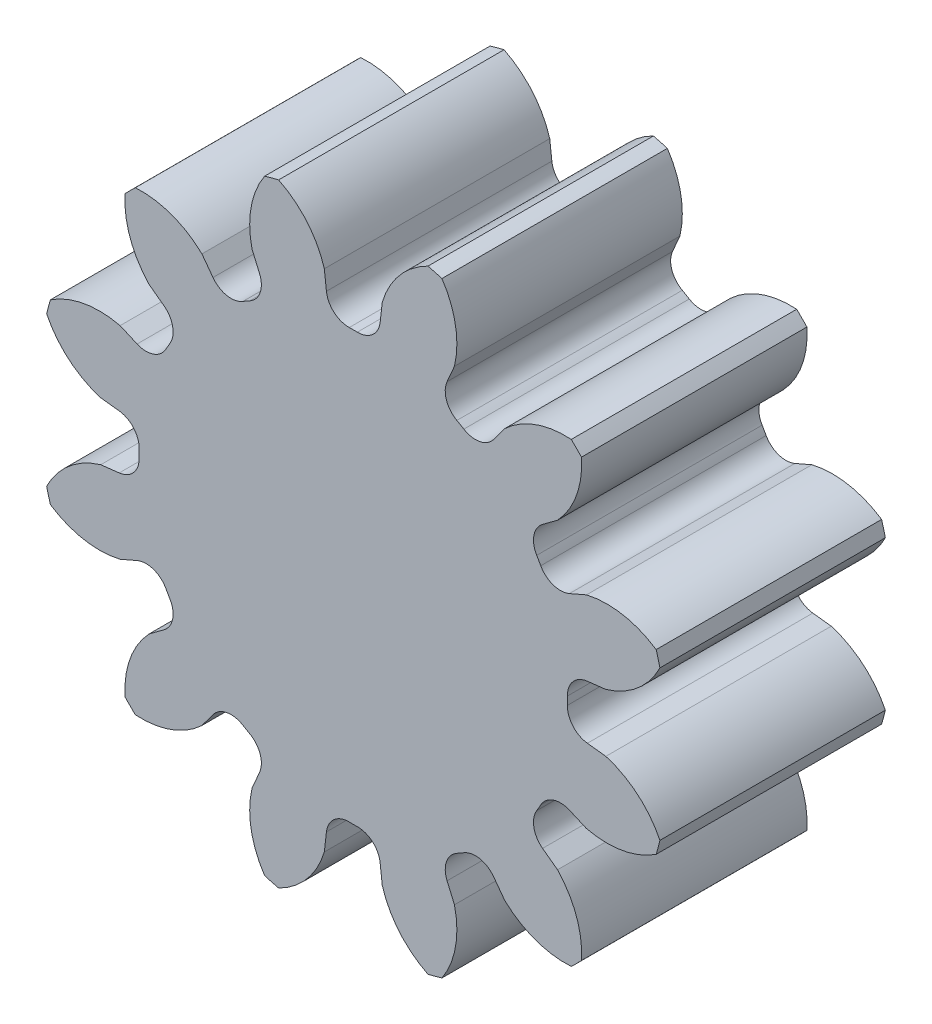
from build123d import *

# Parameters (mm, degrees)
SKETCH1_R                                = 7
DA_CIRCLE_DEPTH                          = 2.5
ONE_TEETH_DEPTH                          = 11.210288928
FILLET_FOR_HIGH_R                        = 0.5
CIRPATTERN_FOR_HIGH_COUNT                = 12
FILLET_FOR_HIGH_OF_CIRPATTERN_FOR_HIGH_R = 0.5


with BuildPart() as part:
    # Sketch1 → Da_circle (new, symmetric)
    with BuildSketch(Plane.XY):
        Circle(SKETCH1_R)
    extrude(amount=DA_CIRCLE_DEPTH, both=True)

    # Sketch → one_teeth (cut, symmetric)
    with BuildSketch(Plane.XY):
        with BuildLine():
            ThreePointArc((-0.54138974, 4.719046212), (0, 4.75), (0.54138974, 4.719046212))
            Line((0.54138974, 4.719046212), (0.642618876, 5.601414192))
            ThreePointArc((0.642618876, 5.601414192), (0.704564548, 5.778410288), (0.783157153, 5.948669168))
            ThreePointArc((0.783157153, 5.948669168), (1.15155426, 6.444705558), (1.656172795, 6.801256625))
            ThreePointArc((1.656172795, 6.801256625), (0, 7), (-1.656172795, 6.801256625))
            ThreePointArc((-1.656172795, 6.801256625), (-1.02382272, 6.30741194), (-0.642618876, 5.601414192))
            Line((-0.642618876, 5.601414192), (-0.54138974, 4.719046212))
        make_face()
    one_teeth = extrude(amount=ONE_TEETH_DEPTH, both=True, mode=Mode.SUBTRACT)

    # Fillet_for_high
    fillet_for_high_edges = [part.edges().sort_by_distance(p)[0] for p in [
        (-0.54138974, 4.719046212, 0),
        (0.54138974, 4.719046212, 0),
    ]]
    fillet(fillet_for_high_edges, radius=FILLET_FOR_HIGH_R)

    # CirPattern_for_high: one_teeth ×12 about axis
    cirpattern_for_high_axis = Axis((0, 0, 2.5), (0, 0, -1))
    for i in range(1, CIRPATTERN_FOR_HIGH_COUNT):
        add(one_teeth.rotate(cirpattern_for_high_axis, i * 360 / CIRPATTERN_FOR_HIGH_COUNT), mode=Mode.SUBTRACT)

    # Fillet_for_high of CirPattern_for_high
    fillet_for_high_of_cirpattern_for_high_edges = [part.edges().sort_by_distance(p)[0] for p in [
        (1.890665838, 4.357508771, 0),
        (2.828380374, 3.816119031, 0),
        (3.816119031, 2.828380374, 0),
        (4.357508771, 1.890665838, 0),
        (4.719046212, 0.54138974, 0),
        (4.719046212, -0.54138974, 0),
        (4.357508771, -1.890665838, 0),
        (3.816119031, -2.828380374, 0),
        (2.828380374, -3.816119031, 0),
        (1.890665838, -4.357508771, 0),
        (0.54138974, -4.719046212, 0),
        (-0.54138974, -4.719046212, 0),
        (-1.890665838, -4.357508771, 0),
        (-2.828380374, -3.816119031, 0),
        (-3.816119031, -2.828380374, 0),
        (-4.357508771, -1.890665838, 0),
        (-4.719046212, -0.54138974, 0),
        (-4.719046212, 0.54138974, 0),
        (-4.357508771, 1.890665838, 0),
        (-3.816119031, 2.828380374, 0),
        (-2.828380374, 3.816119031, 0),
        (-1.890665838, 4.357508771, 0),
    ]]
    fillet(fillet_for_high_of_cirpattern_for_high_edges, radius=FILLET_FOR_HIGH_OF_CIRPATTERN_FOR_HIGH_R)


solid = part.part
